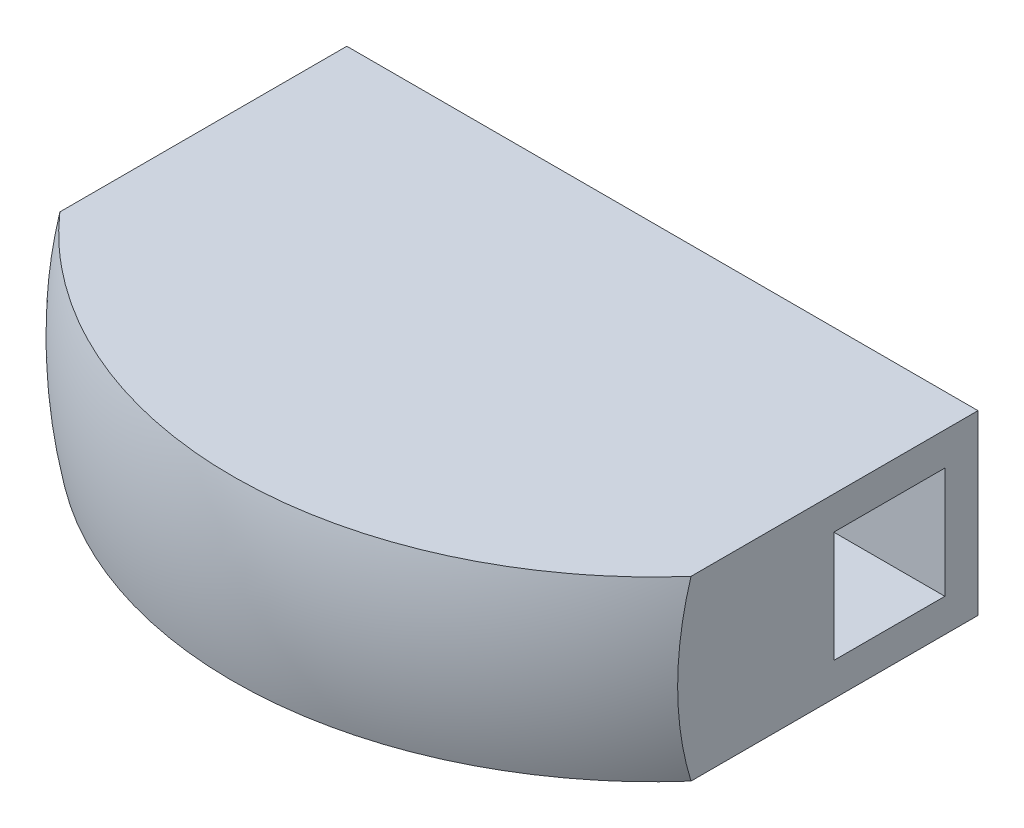
from build123d import *

# Parameters (mm, degrees)
SKETCH1_W           = 5.3528
SKETCH1_H           = 5.3528
SKETCH1_W_2         = 3.3528
SKETCH1_H_2         = 3.3528
BOSS_EXTRUDE1_DEPTH = 9.525
BOSS_EXTRUDE2_START = -5.3528
BOSS_EXTRUDE2_DEPTH = 5.3528


with BuildPart() as part:
    # Sketch1 → Boss-Extrude1 (new, symmetric)
    with BuildSketch(Plane(origin=(0, 0, 0), x_dir=(0, 0, -1), z_dir=(1, 0, 0))):
        with Locations((16.646784182, 0)):
            Rectangle(SKETCH1_W, SKETCH1_H)
        with Locations((16.646784182, 0)):
            Rectangle(SKETCH1_W_2, SKETCH1_H_2, mode=Mode.SUBTRACT)
    extrude(amount=BOSS_EXTRUDE1_DEPTH, both=True)

    # Sketch2 → Boss-Extrude2 (add)
    with BuildSketch(Plane.XZ.offset(2.6764).offset(BOSS_EXTRUDE2_START)):
        with BuildLine():
            Line((-9.525, -13.970384182), (-9.525, -10.258084471))
            ThreePointArc((-9.525, -10.258084471), (0, -6.087615818), (9.525, -10.258084471))
            Line((9.525, -10.258084471), (9.525, -13.970384182))
            Line((9.525, -13.970384182), (-9.525, -13.970384182))
        make_face()
    extrude(amount=BOSS_EXTRUDE2_DEPTH)

    # Sketch3 → Cut-Revolve1 (revolve, cut)
    with BuildSketch(Plane(origin=(0, 0, 0), x_dir=(1, 0, 0), z_dir=(0, 1, 0))):
        with BuildLine():
            Line((-9.525, 10.258084471), (-9.525, -8.791915529))
            Line((-9.525, -8.791915529), (9.525, -8.791915529))
            Line((9.525, -8.791915529), (9.525, 10.258084471))
            ThreePointArc((9.525, 10.258084471), (0, 6.087615818), (-9.525, 10.258084471))
        make_face()
    revolve(axis=Axis((9.525, 0, -19.323184182), (-1, 0, 0)), mode=Mode.SUBTRACT)


solid = part.part
